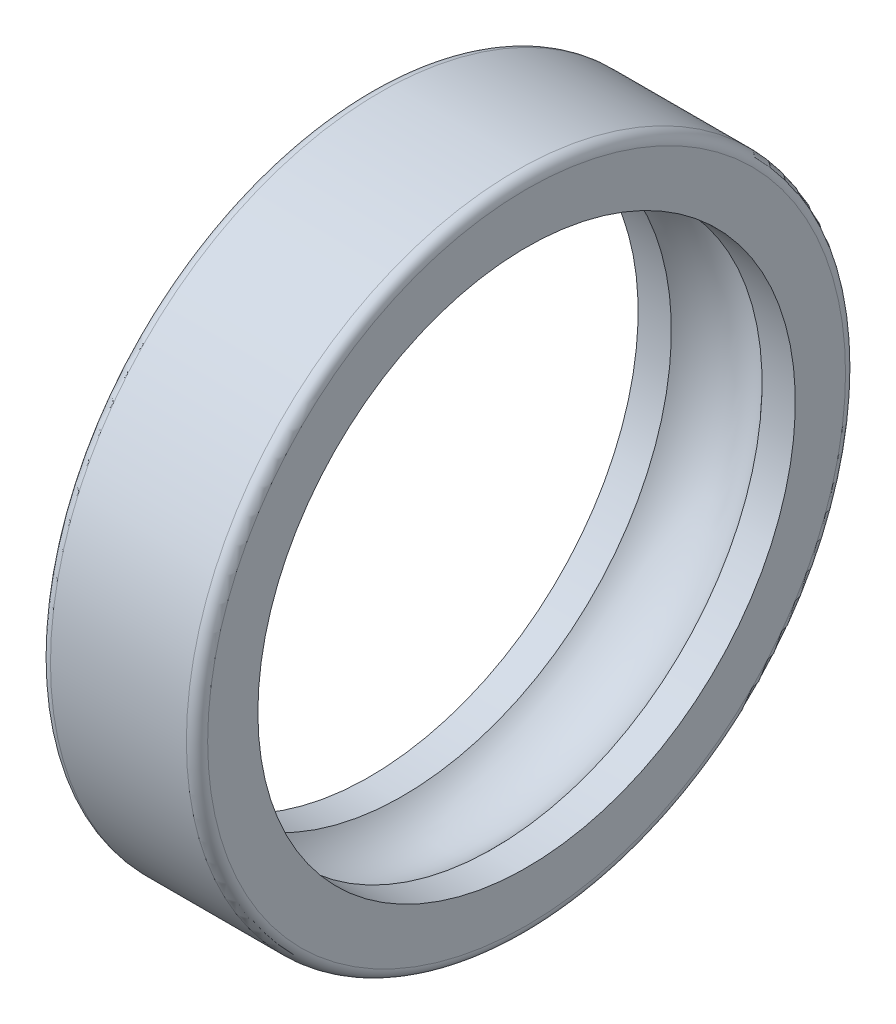
from build123d import *

# Parameters (mm, degrees)
FILLET1_R    = 2.1
SCALE1_SCALE = 0.2
SCALE2_SCALE = 1.9329
SCALE3_SCALE = 1.5


with BuildPart() as part:
    # Sketch1 → Revolve1 (revolve)
    with BuildSketch(Plane.XY, mode=Mode.PRIVATE) as revolve1_sk:
        with BuildLine():
            Line((-31, 65), (0, 65))
            Line((0, 65), (0, 53))
            Line((0, 53), (-6.55572809, 53))
            ThreePointArc((-6.55572809, 53), (-15.5, 57), (-24.44427191, 53))
            Line((-24.44427191, 53), (-31, 53))
            Line((-31, 53), (-31, 65))
        make_face()
    revolve(revolve1_sk.sketch.rotate(Axis((-28.722748815, 0, 0), (1, 0, 0)), 90), axis=Axis((-28.722748815, 0, 0), (1, 0, 0)))

    # Fillet1
    fillet1_edges = [part.edges().sort_by_distance(p)[0] for p in [
        (-31, 0, -65),
        (0, 0, -65),
    ]]
    fillet(fillet1_edges, radius=FILLET1_R)


with BuildPart() as part_1:
    # Scale1: scaled about (-15.5, 0, 0)
    add(part.part.scale(SCALE1_SCALE).moved(Location((-12.4, 0, 0))))


with BuildPart() as part_2:
    # Scale2: scaled about (-15.5, 0, 0)
    add(part_1.part.scale(SCALE2_SCALE).moved(Location((14.45995, 0, 0))))


with BuildPart() as part_3:
    # Scale3: scaled about (-15.5, 0, 0)
    add(part_2.part.scale(SCALE3_SCALE).moved(Location((7.75, 0, 0))))


solid = part_3.part
